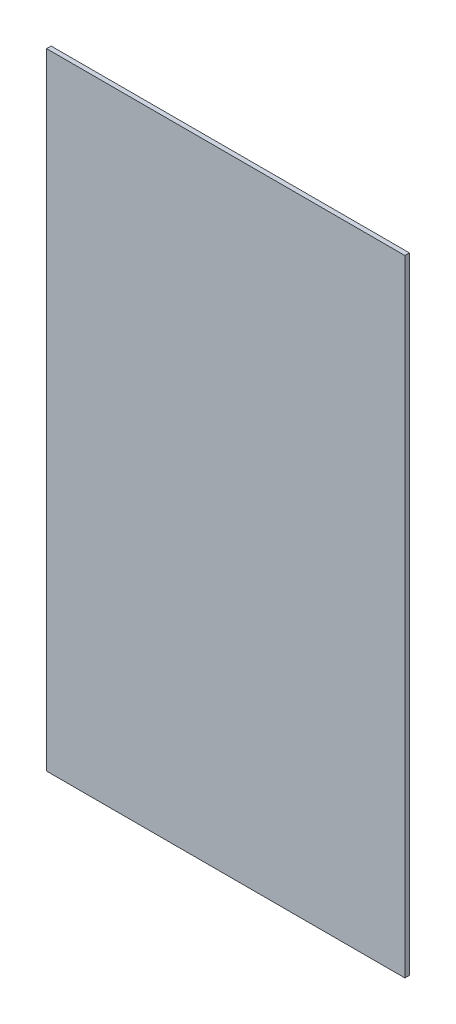
from build123d import *

# Parameters (mm, degrees)
SKETCH1_W           = 63
SKETCH1_H           = 110
BOSS_EXTRUDE1_DEPTH = 0.8


with BuildPart() as part:
    # Sketch1 → Boss-Extrude1 (new body)
    with BuildSketch(Plane.XY):
        with Locations((0.973753223, 22.260428534)):
            Rectangle(SKETCH1_W, SKETCH1_H)
    extrude(amount=BOSS_EXTRUDE1_DEPTH)


solid = part.part
